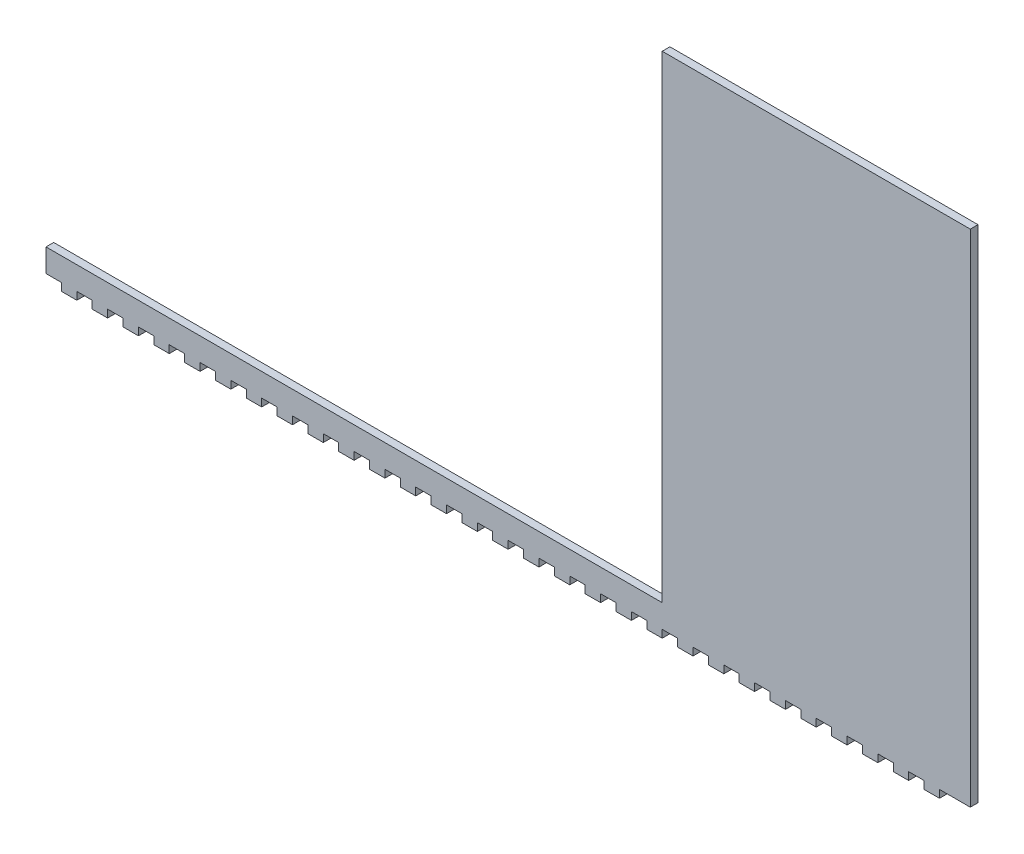
from build123d import *

# Parameters (mm, degrees)
BOSS_EXTRU_1_DEPTH      = 5
ESQUISSE2_W             = 10
ESQUISSE2_H             = 5
ENL_V_MAT_EXTRU_2_DEPTH = 685.780986886


with BuildPart() as part:
    # Esquisse1 → Boss.-Extru.1 (new body)
    with BuildSketch(Plane.XY):
        Polygon((400, 20), (400, 330), (600, 330), (600, 0), (400, 0), (0, 0), (0, 20), align=None)
    extrude(amount=BOSS_EXTRU_1_DEPTH)

    # Esquisse2 → Enlèv. mat.-Extru.2 (cut, through all)
    with BuildSketch(Plane.XY.offset(5)):
        with Locations((25, 2.5)):
            Rectangle(ESQUISSE2_W, ESQUISSE2_H)
        with Locations((5, 2.5)):
            Rectangle(ESQUISSE2_W, ESQUISSE2_H)
        with Locations((45, 2.5)):
            Rectangle(ESQUISSE2_W, ESQUISSE2_H)
        with Locations((65, 2.5)):
            Rectangle(ESQUISSE2_W, ESQUISSE2_H)
        with Locations((85, 2.5)):
            Rectangle(ESQUISSE2_W, ESQUISSE2_H)
        with Locations((105, 2.5)):
            Rectangle(ESQUISSE2_W, ESQUISSE2_H)
        with Locations((125, 2.5)):
            Rectangle(ESQUISSE2_W, ESQUISSE2_H)
        with Locations((145, 2.5)):
            Rectangle(ESQUISSE2_W, ESQUISSE2_H)
        with Locations((165, 2.5)):
            Rectangle(ESQUISSE2_W, ESQUISSE2_H)
        with Locations((185, 2.5)):
            Rectangle(ESQUISSE2_W, ESQUISSE2_H)
        with Locations((205, 2.5)):
            Rectangle(ESQUISSE2_W, ESQUISSE2_H)
        with Locations((225, 2.5)):
            Rectangle(ESQUISSE2_W, ESQUISSE2_H)
        with Locations((245, 2.5)):
            Rectangle(ESQUISSE2_W, ESQUISSE2_H)
        with Locations((265, 2.5)):
            Rectangle(ESQUISSE2_W, ESQUISSE2_H)
        with Locations((285, 2.5)):
            Rectangle(ESQUISSE2_W, ESQUISSE2_H)
        with Locations((305, 2.5)):
            Rectangle(ESQUISSE2_W, ESQUISSE2_H)
        with Locations((325, 2.5)):
            Rectangle(ESQUISSE2_W, ESQUISSE2_H)
        with Locations((345, 2.5)):
            Rectangle(ESQUISSE2_W, ESQUISSE2_H)
        with Locations((365, 2.5)):
            Rectangle(ESQUISSE2_W, ESQUISSE2_H)
        with Locations((385, 2.5)):
            Rectangle(ESQUISSE2_W, ESQUISSE2_H)
        with Locations((405, 2.5)):
            Rectangle(ESQUISSE2_W, ESQUISSE2_H)
        with Locations((425, 2.5)):
            Rectangle(ESQUISSE2_W, ESQUISSE2_H)
        with Locations((445, 2.5)):
            Rectangle(ESQUISSE2_W, ESQUISSE2_H)
        with Locations((465, 2.5)):
            Rectangle(ESQUISSE2_W, ESQUISSE2_H)
        with Locations((485, 2.5)):
            Rectangle(ESQUISSE2_W, ESQUISSE2_H)
        with Locations((505, 2.5)):
            Rectangle(ESQUISSE2_W, ESQUISSE2_H)
        with Locations((525, 2.5)):
            Rectangle(ESQUISSE2_W, ESQUISSE2_H)
        with Locations((545, 2.5)):
            Rectangle(ESQUISSE2_W, ESQUISSE2_H)
        with Locations((565, 2.5)):
            Rectangle(ESQUISSE2_W, ESQUISSE2_H)
        Polygon((580, 0), (580, 5), (590, 5), (600, 5), (600, 0), (590, 0), align=None)
    extrude(amount=-ENL_V_MAT_EXTRU_2_DEPTH, mode=Mode.SUBTRACT)


solid = part.part
